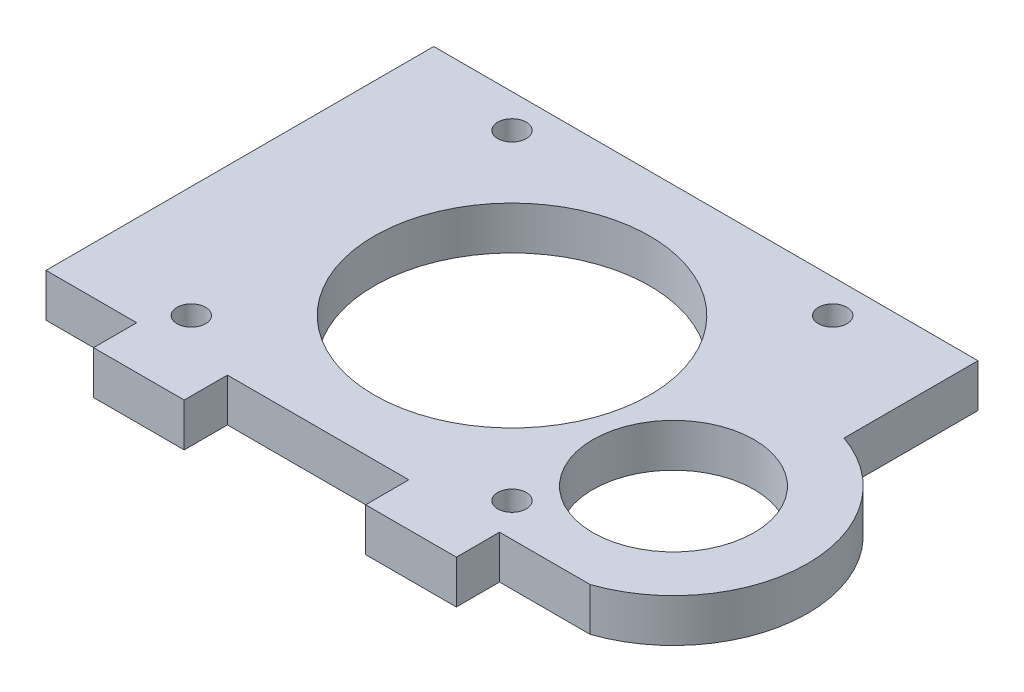
from build123d import *

# Parameters (mm, degrees)
SKETCH1_W           = 80
SKETCH1_H           = 63.35
BOSS_EXTRUDE1_DEPTH = 6.35
SKETCH2_W           = 13.333333333
SKETCH2_H           = 6.35
SKETCH2_W_2         = 26.666666666
CUT_EXTRUDE2_DEPTH  = 52.416224336
SKETCH3_R           = 20.25
CUT_EXTRUDE3_DEPTH  = 2.55
SKETCH4_R           = 20.25
CUT_EXTRUDE4_DEPTH  = 52.416224336
SKETCH5_R           = 2.1
CUT_EXTRUDE5_DEPTH  = 52.416224336
BOSS_EXTRUDE2_DEPTH = 6.35
SKETCH13_R          = 11.85
CUT_EXTRUDE8_DEPTH  = 10


with BuildPart() as part:
    # Sketch1 → Boss-Extrude1 (new body)
    with BuildSketch(Plane(origin=(0, 0, 0), x_dir=(1, 0, 0), z_dir=(0, 1, 0))):
        Rectangle(SKETCH1_W, SKETCH1_H)
    extrude(amount=BOSS_EXTRUDE1_DEPTH)

    # Sketch2 → Cut-Extrude2 (cut, through all)
    with BuildSketch(Plane(origin=(0, 6.35, 0), x_dir=(1, 0, 0), z_dir=(0, 1, 0))):
        with Locations((-33.333333334, -28.5)):
            Rectangle(SKETCH2_W, SKETCH2_H)
        with Locations((33.333333334, -28.5)):
            Rectangle(SKETCH2_W, SKETCH2_H)
        with Locations((0, -28.5)):
            Rectangle(SKETCH2_W_2, SKETCH2_H)
    extrude(amount=-CUT_EXTRUDE2_DEPTH, mode=Mode.SUBTRACT)

    # Sketch3 → Cut-Extrude3 (cut)
    with BuildSketch(Plane(origin=(0, 6.35, 0), x_dir=(1, 0, 0), z_dir=(0, 1, 0))):
        with Locations(Location((0, 3.175, 0), (0, 0, 270))):
            Circle(SKETCH3_R)
    extrude(amount=-CUT_EXTRUDE3_DEPTH, mode=Mode.SUBTRACT)

    # Sketch4 → Cut-Extrude4 (cut, through all)
    with BuildSketch(Plane(origin=(0, 6.35, 0), x_dir=(1, 0, 0), z_dir=(0, 1, 0))):
        with Locations(Location((0, 3.175, 0), (0, 0, 270))):
            Circle(SKETCH4_R)
    extrude(amount=-CUT_EXTRUDE4_DEPTH, mode=Mode.SUBTRACT)

    # Sketch5 → Cut-Extrude5 (cut, through all)
    with BuildSketch(Plane(origin=(0, 6.35, 0), x_dir=(1, 0, 0), z_dir=(0, 1, 0))):
        with Locations(Location((23.57, 26.745, 0), (0, 0, 270))):
            Circle(SKETCH5_R)
        with Locations(Location((-23.57, 26.745, 0), (0, 0, 270))):
            Circle(SKETCH5_R)
        with Locations(Location((-23.57, -20.395, 0), (0, 0, 270))):
            Circle(SKETCH5_R)
        with Locations(Location((23.57, -20.395, 0), (0, 0, 270))):
            Circle(SKETCH5_R)
    extrude(amount=-CUT_EXTRUDE5_DEPTH, mode=Mode.SUBTRACT)

    # Sketch12 → Boss-Extrude2 (add)
    with BuildSketch(Plane.XZ):
        with BuildLine():
            Line((40, 25.325), (40, -11.975))
            ThreePointArc((40, -11.975), (53.30769606, 6.675), (40, 25.325))
        make_face()
    extrude(amount=-BOSS_EXTRUDE2_DEPTH)

    # Sketch13 → Cut-Extrude8 (cut)
    with BuildSketch(Plane.XZ):
        with Locations(Location((33.585376282, 6.675, 0), (0, 0, 270))):
            Circle(SKETCH13_R)
    extrude(amount=-CUT_EXTRUDE8_DEPTH, mode=Mode.SUBTRACT)


solid = part.part
